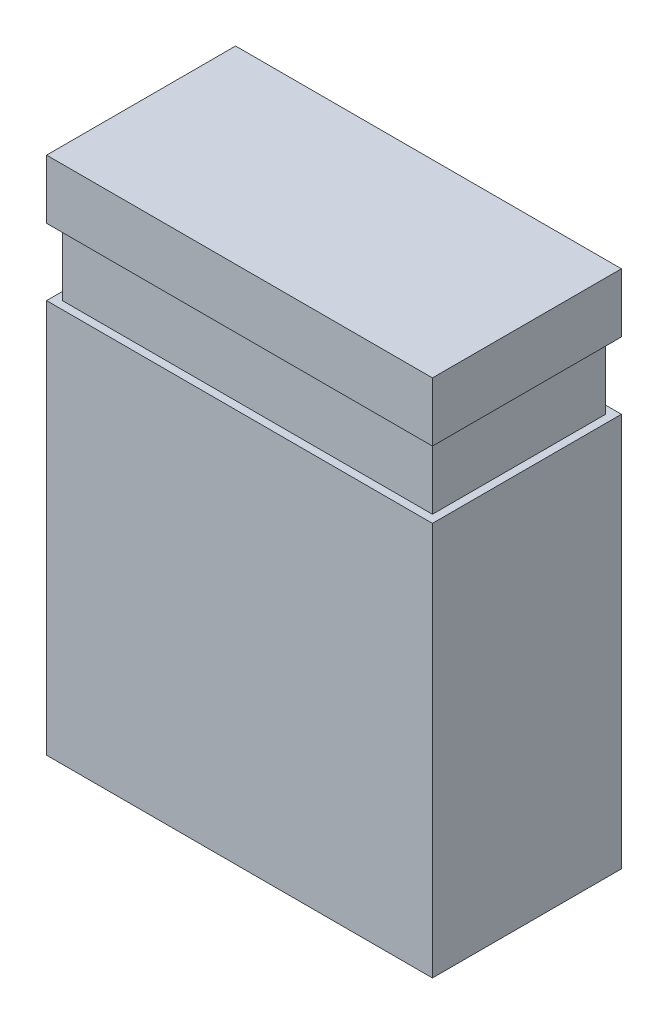
from build123d import *

# Parameters (mm, degrees)
SKICA1_W                 = 4.9
SKICA1_H                 = 6.6
P_IDAT_VYSUNUT_M1_DEPTH  = 2.4
SKICA2_W                 = 4.9
SKICA2_H                 = 0.85
ODEBRAT_VYSUNUT_M1_DEPTH = 0.1
SKICA3_W                 = 2.3
SKICA3_H                 = 0.85
ODEBRAT_VYSUNUT_M2_DEPTH = 0.1
SKICA4_W                 = 4.8
SKICA4_H                 = 0.85
ODEBRAT_VYSUNUT_M3_DEPTH = 0.1
SKICA5_W                 = 2.2
SKICA5_H                 = 0.85
ODEBRAT_VYSUNUT_M4_DEPTH = 0.1


with BuildPart() as part:
    # Skica1 → Přidat vysunutím1 (new body)
    with BuildSketch(Plane.XY):
        with Locations((-2.45, 3.3)):
            Rectangle(SKICA1_W, SKICA1_H)
    extrude(amount=P_IDAT_VYSUNUT_M1_DEPTH)

    # Skica2 → Odebrat vysunutím1 (cut)
    with BuildSketch(Plane.XY.offset(2.4)):
        with Locations((-2.45, 5.425)):
            Rectangle(SKICA2_W, SKICA2_H)
    extrude(amount=-ODEBRAT_VYSUNUT_M1_DEPTH, mode=Mode.SUBTRACT)

    # Skica3 → Odebrat vysunutím2 (cut)
    with BuildSketch(Plane(origin=(0, 0, 0), x_dir=(0, 0, -1), z_dir=(1, 0, 0))):
        with Locations((-1.15, 5.425)):
            Rectangle(SKICA3_W, SKICA3_H)
    extrude(amount=-ODEBRAT_VYSUNUT_M2_DEPTH, mode=Mode.SUBTRACT)

    # Skica4 → Odebrat vysunutím3 (cut)
    with BuildSketch(Plane(origin=(0, 0, 0), x_dir=(-1, 0, 0), z_dir=(0, 0, -1))):
        with Locations((2.5, 5.425)):
            Rectangle(SKICA4_W, SKICA4_H)
    extrude(amount=-ODEBRAT_VYSUNUT_M3_DEPTH, mode=Mode.SUBTRACT)

    # Skica5 → Odebrat vysunutím4 (cut)
    with BuildSketch(Plane.ZY.offset(4.9)):
        with Locations((1.2, 5.425)):
            Rectangle(SKICA5_W, SKICA5_H)
    extrude(amount=-ODEBRAT_VYSUNUT_M4_DEPTH, mode=Mode.SUBTRACT)


solid = part.part
